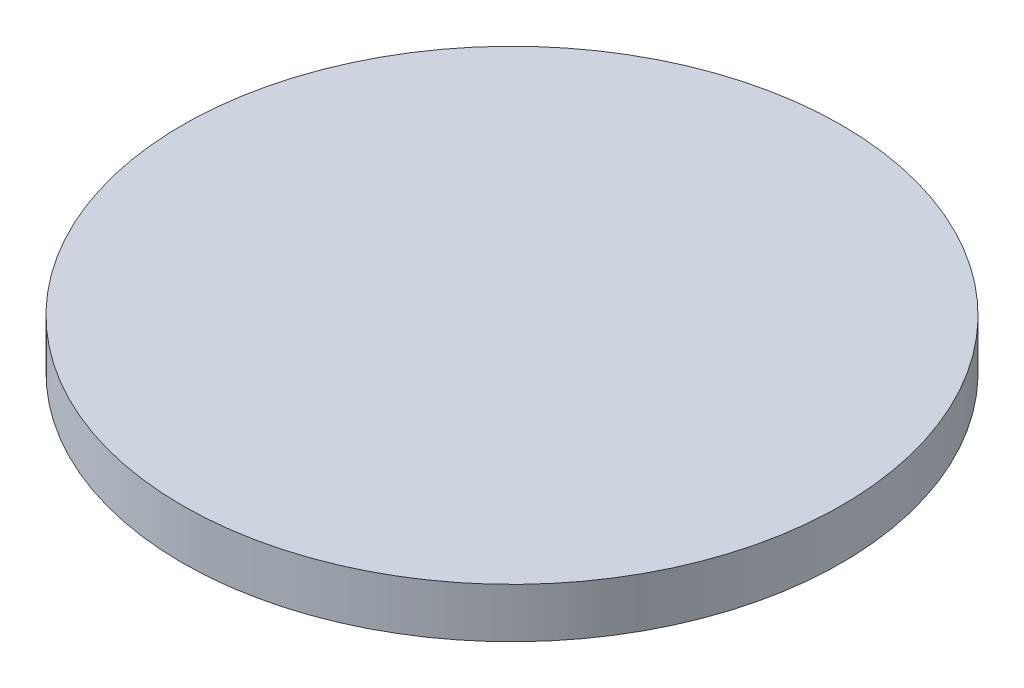
from build123d import *

# Parameters (mm, degrees)
SKETCH1_R           = 8.9535
BOSS_EXTRUDE1_DEPTH = 1.35


with BuildPart() as part:
    # Sketch1 → Boss-Extrude1 (new body)
    with BuildSketch(Plane(origin=(0, 0, 0), x_dir=(1, 0, 0), z_dir=(0, 1, 0))):
        with Locations(Location((0, 0, 0), (0, 0, 90))):
            Circle(SKETCH1_R)
    extrude(amount=BOSS_EXTRUDE1_DEPTH)


solid = part.part
